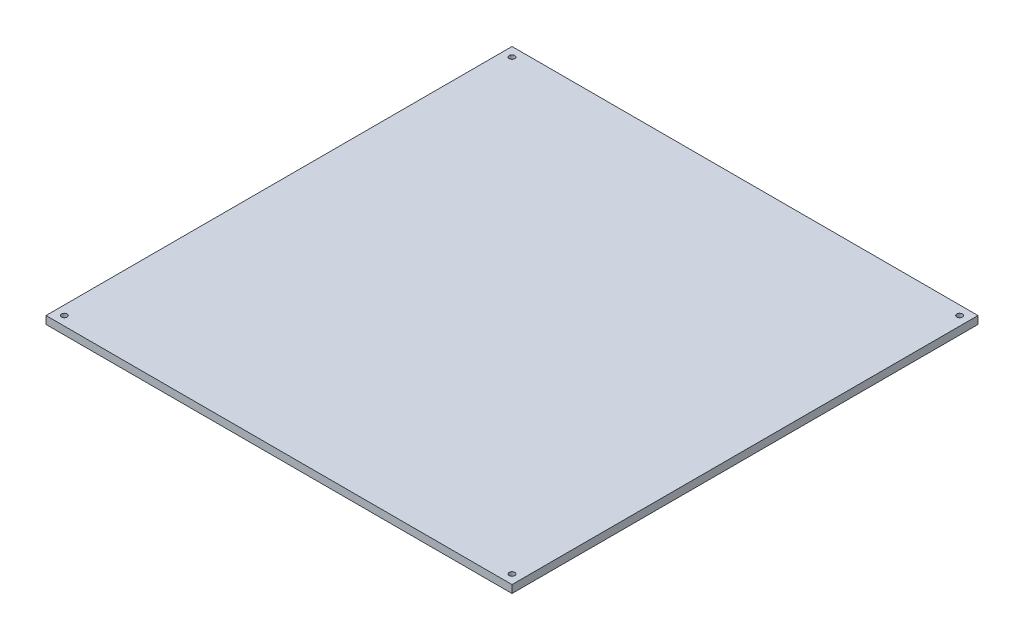
from build123d import *

# Parameters (mm, degrees)
SKETCH1_W                                           = 300
SKETCH1_H                                           = 300
BOSS_EXTRUDE1_DEPTH                                 = 5
CSK_FOR_M3_COUNTERSUNK_FLAT_HEAD_SCREW1_D           = 3.6
CSK_FOR_M3_COUNTERSUNK_FLAT_HEAD_SCREW1_CSINK_D     = 6.3
CSK_FOR_M3_COUNTERSUNK_FLAT_HEAD_SCREW1_CSINK_ANGLE = 90


with BuildPart() as part:
    # Sketch1 → Boss-Extrude1 (new body)
    with BuildSketch(Plane(origin=(0, 0, 0), x_dir=(1, 0, 0), z_dir=(0, 1, 0))):
        Rectangle(SKETCH1_W, SKETCH1_H)
    extrude(amount=BOSS_EXTRUDE1_DEPTH)

    # CSK for M3 Countersunk Flat Head Screw1 (through all)
    with Locations(Plane(origin=(144.1, 0, 144.1), x_dir=(0, 0, -1), z_dir=(0, -1, 0))):
        with Locations((0, 0), (0, -288.2), (288.2, -288.2), (288.2, 0)):
            CounterSinkHole(CSK_FOR_M3_COUNTERSUNK_FLAT_HEAD_SCREW1_D / 2, CSK_FOR_M3_COUNTERSUNK_FLAT_HEAD_SCREW1_CSINK_D / 2, counter_sink_angle=CSK_FOR_M3_COUNTERSUNK_FLAT_HEAD_SCREW1_CSINK_ANGLE)


solid = part.part
